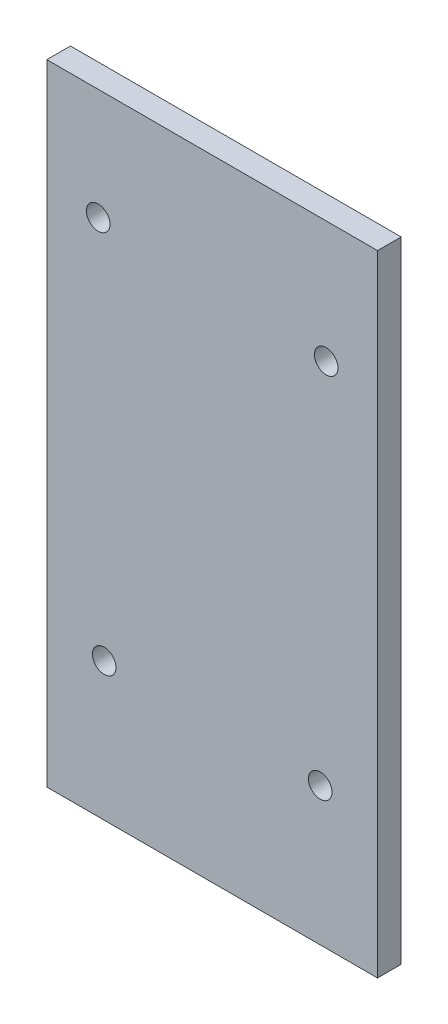
from build123d import *

# Parameters (mm, degrees)
SCHIZZO1_W                   = 70
SCHIZZO1_H                   = 133.34
ESTRUSIONE_ESTRUSIONE1_DEPTH = 5
SCHIZZO2_R                   = 2.5
TAGLIO_ESTRUSIONE1_DEPTH     = 20


with BuildPart() as part:
    # Schizzo1 → Estrusione-Estrusione1 (new body)
    with BuildSketch(Plane.XY):
        Rectangle(SCHIZZO1_W, SCHIZZO1_H)
    extrude(amount=ESTRUSIONE_ESTRUSIONE1_DEPTH)

    # Schizzo2 → Taglio-Estrusione1 (cut)
    with BuildSketch(Plane.XY.offset(5)):
        with Locations((-24.13, 43.15)):
            Circle(SCHIZZO2_R)
        with Locations((24.13, 40.95)):
            Circle(SCHIZZO2_R)
        with Locations((22.86, -37.46)):
            Circle(SCHIZZO2_R)
        with Locations((-22.86, -37.46)):
            Circle(SCHIZZO2_R)
    extrude(amount=-TAGLIO_ESTRUSIONE1_DEPTH, mode=Mode.SUBTRACT)


solid = part.part
